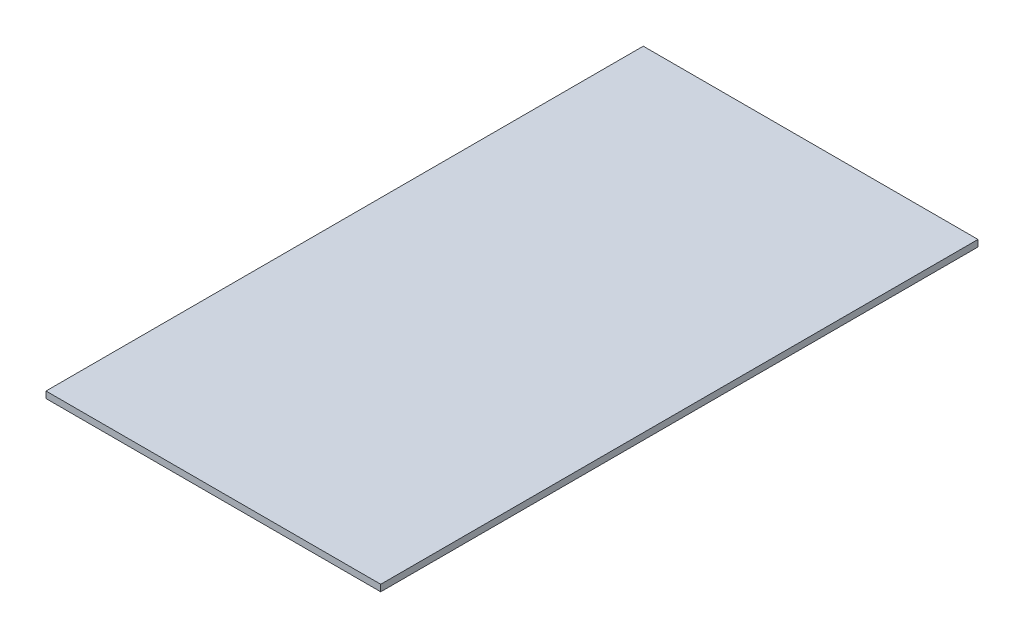
from build123d import *

# Parameters (mm, degrees)
BOSS_EXTRUDE1_START = 415.676617
SKETCH1_W           = 255
SKETCH1_H           = 455
BOSS_EXTRUDE1_DEPTH = 5


with BuildPart() as part:
    # Sketch1 → Boss-Extrude1 (new body)
    with BuildSketch(Plane(origin=(0, 0, 0), x_dir=(1, 0, 0), z_dir=(0, 1, 0)).offset(BOSS_EXTRUDE1_START)):
        with Locations((143.794028937, 55.800739351)):
            Rectangle(SKETCH1_W, SKETCH1_H)
    extrude(amount=BOSS_EXTRUDE1_DEPTH)


solid = part.part
